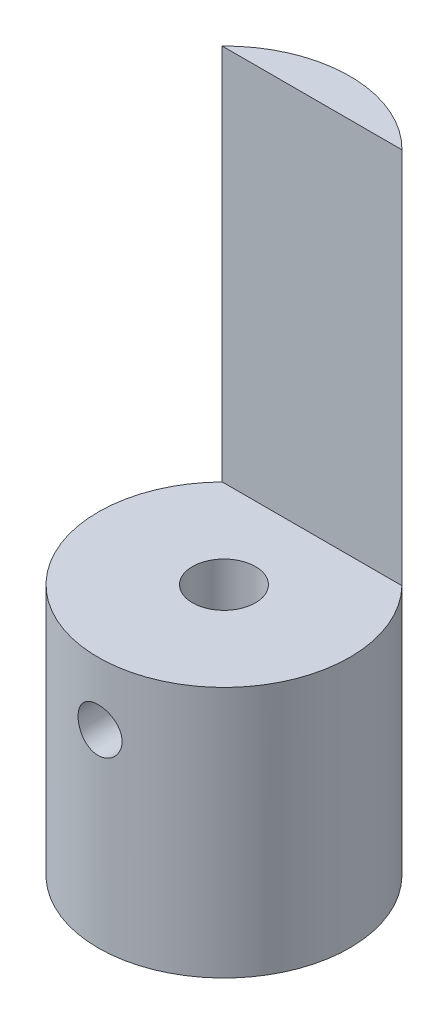
from build123d import *

# Parameters (mm, degrees)
CROQUIS1_R                 = 10
SALIENTE_EXTRUIR1_DEPTH    = 25
CROQUIS3_R                 = 2.5
CORTAR_EXTRUIR2_DEPTH      = 52.961524227
CORTAR_EXTRUIR1_DEPTH      = 30
CORTAR_EXTRUIR3_REACH      = 39.417
CORTAR_EXTRUIR3_END_RADIUS = 2.5
CROQUIS7_R                 = 1.75


with BuildPart() as part:
    # Croquis1 → Saliente-Extruir1 (new, symmetric)
    with BuildSketch(Plane(origin=(0, 0, 0), x_dir=(1, 0, 0), z_dir=(0, 1, 0))):
        with Locations(Location((0, 0, 0), (0, 0, 270))):
            Circle(CROQUIS1_R)
    extrude(amount=SALIENTE_EXTRUIR1_DEPTH, both=True)

    # Croquis3 → Cortar-Extruir2 (cut, through all)
    with BuildSketch(Plane(origin=(0, 25, 0), x_dir=(1, 0, 0), z_dir=(0, 1, 0))):
        with Locations(Location((0, 0, 0), (0, 0, 270))):
            Circle(CROQUIS3_R)
    extrude(amount=-CORTAR_EXTRUIR2_DEPTH, mode=Mode.SUBTRACT)

    # Croquis2 → Cortar-Extruir1 (cut)
    with BuildSketch(Plane(origin=(0, 25, 0), x_dir=(1, 0, 0), z_dir=(0, 1, 0))):
        with BuildLine():
            Line((-7.141428429, 7), (7.141428429, 7))
            ThreePointArc((7.141428429, 7), (0, -10), (-7.141428429, 7))
        make_face()
    extrude(amount=-CORTAR_EXTRUIR1_DEPTH, mode=Mode.SUBTRACT)

    # Cortar-Extruir3: up to this cylinder (the profile starts outside it)
    cortar_extruir3_end = Plane(origin=(0, -10, 0), z_dir=(0, 1, 0)) * Cylinder(CORTAR_EXTRUIR3_END_RADIUS, 84.834, mode=Mode.PRIVATE)
    # Croquis7 → Cortar-Extruir3 (cut, up to the surface)
    with BuildSketch(Plane(origin=(0, -5, 10), x_dir=(1, 0, 0), z_dir=(0, 0, 1)), mode=Mode.PRIVATE) as cortar_extruir3_sk1:
        with Locations((0, -5)):
            Circle(CROQUIS7_R)
    cortar_extruir3_tool1 = extrude(cortar_extruir3_sk1.sketch, amount=-CORTAR_EXTRUIR3_REACH, mode=Mode.PRIVATE) - cortar_extruir3_end
    add(cortar_extruir3_tool1.solids().sort_by_distance((0, -10, 10))[0], mode=Mode.SUBTRACT)


solid = part.part
